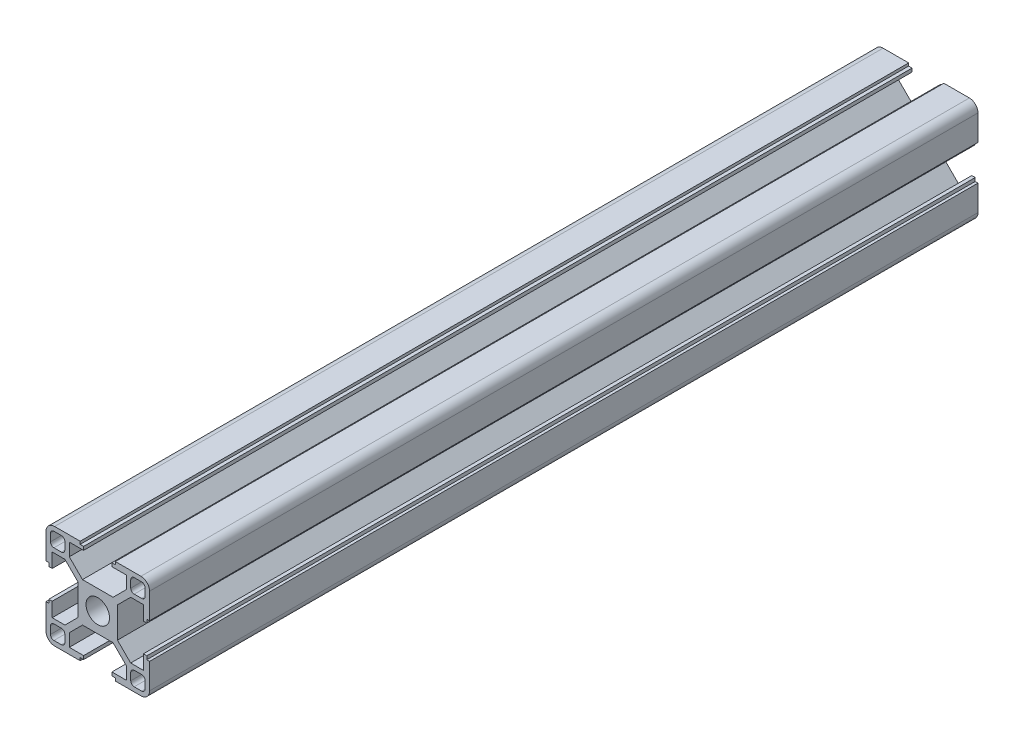
from build123d import *

# Parameters (mm, degrees)
SKETCH1_R      = 3.4
EXTRUDE1_DEPTH = 240
EXTRUDE2_DEPTH = 241.935676063


with BuildPart() as part:
    # Sketch1 → Extrude1 (new body)
    with BuildSketch(Plane.XY):
        with BuildLine():
            Line((-5.1, 14.2), (-5.1, 15))
            Line((-5.1, 15), (-12.5, 15))
            ThreePointArc((-12.5, 15), (-14.267766953, 14.267766953), (-15, 12.5))
            Line((-15, 12.5), (-15, 5.1))
            Line((-15, 5.1), (-14.2, 5.1))
            Line((-14.2, 5.1), (-14.2, 4.1))
            Line((-14.2, 4.1), (-13.2, 4.1))
            Line((-13.2, 4.1), (-13.2, 8.25))
            Line((-13.2, 8.25), (-9.522792206, 8.25))
            Line((-9.522792206, 8.25), (-5.7, 4.427207794))
            Line((-5.7, 4.427207794), (-5.7, -4.427207794))
            Line((-5.7, -4.427207794), (-9.522792206, -8.25))
            Line((-9.522792206, -8.25), (-13.2, -8.25))
            Line((-13.2, -8.25), (-13.2, -4.1))
            Line((-13.2, -4.1), (-14.2, -4.1))
            Line((-14.2, -4.1), (-14.2, -5.1))
            Line((-14.2, -5.1), (-15, -5.1))
            Line((-15, -5.1), (-15, -12.5))
            ThreePointArc((-15, -12.5), (-14.267766953, -14.267766953), (-12.5, -15))
            Line((-12.5, -15), (-5.1, -15))
            Line((-5.1, -15), (-5.1, -14.2))
            Line((-5.1, -14.2), (-4.1, -14.2))
            Line((-4.1, -14.2), (-4.1, -13.2))
            Line((-4.1, -13.2), (-8.25, -13.2))
            Line((-8.25, -13.2), (-8.25, -9.522792206))
            Line((-8.25, -9.522792206), (-4.427207794, -5.7))
            Line((-4.427207794, -5.7), (4.427207794, -5.7))
            Line((4.427207794, -5.7), (8.25, -9.522792206))
            Line((8.25, -9.522792206), (8.25, -13.2))
            Line((8.25, -13.2), (4.1, -13.2))
            Line((4.1, -13.2), (4.1, -14.2))
            Line((4.1, -14.2), (5.1, -14.2))
            Line((5.1, -14.2), (5.1, -15))
            Line((5.1, -15), (12.5, -15))
            ThreePointArc((12.5, -15), (14.267766953, -14.267766953), (15, -12.5))
            Line((15, -12.5), (15, -5.1))
            Line((15, -5.1), (14.2, -5.1))
            Line((14.2, -5.1), (14.2, -4.1))
            Line((14.2, -4.1), (13.2, -4.1))
            Line((13.2, -4.1), (13.2, -8.25))
            Line((13.2, -8.25), (9.522792206, -8.25))
            Line((9.522792206, -8.25), (5.7, -4.427207794))
            Line((5.7, -4.427207794), (5.7, 4.427207794))
            Line((5.7, 4.427207794), (9.522792206, 8.25))
            Line((9.522792206, 8.25), (13.2, 8.25))
            Line((13.2, 8.25), (13.2, 4.1))
            Line((13.2, 4.1), (14.2, 4.1))
            Line((14.2, 4.1), (14.2, 5.1))
            Line((14.2, 5.1), (15, 5.1))
            Line((15, 5.1), (15, 12.5))
            ThreePointArc((15, 12.5), (14.267766953, 14.267766953), (12.5, 15))
            Line((12.5, 15), (5.1, 15))
            Line((5.1, 15), (5.1, 14.2))
            Line((5.1, 14.2), (4.1, 14.2))
            Line((4.1, 14.2), (4.1, 13.2))
            Line((4.1, 13.2), (8.25, 13.2))
            Line((8.25, 13.2), (8.25, 9.522792206))
            Line((8.25, 9.522792206), (4.427207794, 5.7))
            Line((4.427207794, 5.7), (-4.427207794, 5.7))
            Line((-4.427207794, 5.7), (-8.25, 9.522792206))
            Line((-8.25, 9.522792206), (-8.25, 13.2))
            Line((-8.25, 13.2), (-4.1, 13.2))
            Line((-4.1, 13.2), (-4.1, 14.2))
            Line((-4.1, 14.2), (-5.1, 14.2))
        make_face()
        Circle(SKETCH1_R, mode=Mode.SUBTRACT)
    extrude(amount=EXTRUDE1_DEPTH)

    # Sketch2 → Extrude2 (cut, through all)
    with BuildSketch(Plane.XY.offset(240)):
        with BuildLine():
            Line((13.7, 12.7), (13.7, 10.55))
            ThreePointArc((13.7, 10.55), (13.407106781, 9.842893219), (12.7, 9.55))
            Line((12.7, 9.55), (10.55, 9.55))
            ThreePointArc((10.55, 9.55), (9.842893219, 9.842893219), (9.55, 10.55))
            Line((9.55, 10.55), (9.55, 12.7))
            ThreePointArc((9.55, 12.7), (9.842893219, 13.407106781), (10.55, 13.7))
            Line((10.55, 13.7), (12.7, 13.7))
            ThreePointArc((12.7, 13.7), (13.407106781, 13.407106781), (13.7, 12.7))
        make_face()
        with BuildLine():
            Line((-12.7, 13.7), (-10.55, 13.7))
            ThreePointArc((-10.55, 13.7), (-9.842893219, 13.407106781), (-9.55, 12.7))
            Line((-9.55, 12.7), (-9.55, 10.55))
            ThreePointArc((-9.55, 10.55), (-9.842893219, 9.842893219), (-10.55, 9.55))
            Line((-10.55, 9.55), (-12.7, 9.55))
            ThreePointArc((-12.7, 9.55), (-13.407106781, 9.842893219), (-13.7, 10.55))
            Line((-13.7, 10.55), (-13.7, 12.7))
            ThreePointArc((-13.7, 12.7), (-13.407106781, 13.407106781), (-12.7, 13.7))
        make_face()
        with BuildLine():
            Line((12.7, -13.7), (10.55, -13.7))
            ThreePointArc((10.55, -13.7), (9.842893219, -13.407106781), (9.55, -12.7))
            Line((9.55, -12.7), (9.55, -10.55))
            ThreePointArc((9.55, -10.55), (9.842893219, -9.842893219), (10.55, -9.55))
            Line((10.55, -9.55), (12.7, -9.55))
            ThreePointArc((12.7, -9.55), (13.407106781, -9.842893219), (13.7, -10.55))
            Line((13.7, -10.55), (13.7, -12.7))
            ThreePointArc((13.7, -12.7), (13.407106781, -13.407106781), (12.7, -13.7))
        make_face()
        with BuildLine():
            Line((-13.7, -12.7), (-13.7, -10.55))
            ThreePointArc((-13.7, -10.55), (-13.407106781, -9.842893219), (-12.7, -9.55))
            Line((-12.7, -9.55), (-10.55, -9.55))
            ThreePointArc((-10.55, -9.55), (-9.842893219, -9.842893219), (-9.55, -10.55))
            Line((-9.55, -10.55), (-9.55, -12.7))
            ThreePointArc((-9.55, -12.7), (-9.842893219, -13.407106781), (-10.55, -13.7))
            Line((-10.55, -13.7), (-12.7, -13.7))
            ThreePointArc((-12.7, -13.7), (-13.407106781, -13.407106781), (-13.7, -12.7))
        make_face()
    extrude(amount=-EXTRUDE2_DEPTH, mode=Mode.SUBTRACT)


solid = part.part
